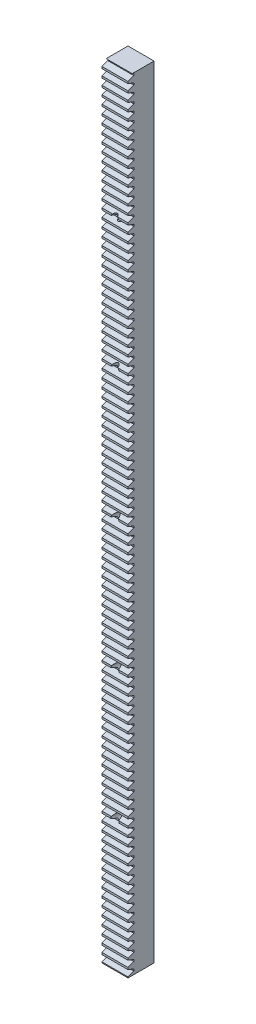
from build123d import *

# Parameters (mm, degrees)
SKETCH_3_W             = 20
SKETCH_3_H             = 20
EXTRUDE_1_DEPTH        = 600
CUT_EXTRUDE_1_REACH    = 602.666
PATTERN_LINEAR_1_COUNT = 96
PATTERN_LINEAR_1_PITCH = 6.27
SKETCH_5_R             = 4
CUT_EXTRUDE_2_DEPTH    = 20
SKETCH_6_R             = 3
CUT_EXTRUDE_3_DEPTH    = 601.666296707


with BuildPart() as part:
    # 草图3 → 凸台-拉伸1 (new body)
    with BuildSketch(Plane(origin=(0, 0, 0), x_dir=(1, 0, 0), z_dir=(0, 1, 0))):
        with Locations((10, 10)):
            Rectangle(SKETCH_3_W, SKETCH_3_H)
    extrude(amount=EXTRUDE_1_DEPTH)

    # 草图4 → 切除-拉伸1 (cut, up to next)
    with BuildSketch(Plane(origin=(0, 0, 0), x_dir=(0, 0, -1), z_dir=(1, 0, 0)), mode=Mode.PRIVATE) as cut_extrude_1_sk1:
        Polygon((0, 0), (0, 0.748566973), (4.5, 2.386433027), (4.5, 3.883566973), (0, 5.521433027), (0, 6.27), (-2, 6.27), (-2, 0), align=None)
    cut_extrude_1_tool1 = extrude(cut_extrude_1_sk1.sketch, amount=CUT_EXTRUDE_1_REACH, mode=Mode.PRIVATE) & part.part
    cut_extrude_1 = cut_extrude_1_tool1.solids().sort_by_distance((0, 3.135, -0.513147))[0]
    add(cut_extrude_1, mode=Mode.SUBTRACT)

    # 阵列(线性)1: 切除-拉伸1 ×96
    with Locations(*[(0, i * PATTERN_LINEAR_1_PITCH, 0) for i in range(1, PATTERN_LINEAR_1_COUNT)]):
        add(cut_extrude_1, mode=Mode.SUBTRACT)

    # 草图5 → 切除-拉伸2 (cut)
    with BuildSketch(Plane(origin=(0, 0, 0), x_dir=(1, 0, 0), z_dir=(0, 1, 0))):
        with Locations(Location((10, 10, 0), (0, 0, 270))):
            Circle(SKETCH_5_R)
    extrude(amount=CUT_EXTRUDE_2_DEPTH, mode=Mode.SUBTRACT)

    # 草图6 → 切除-拉伸3 (cut, through all)
    with BuildSketch(Plane.XY):
        with Locations((10, 100)):
            Circle(SKETCH_6_R)
        with Locations((10, 200)):
            Circle(SKETCH_6_R)
        with Locations((10, 300)):
            Circle(SKETCH_6_R)
        with Locations((10, 400)):
            Circle(SKETCH_6_R)
        with Locations((10, 500)):
            Circle(SKETCH_6_R)
    extrude(amount=-CUT_EXTRUDE_3_DEPTH, mode=Mode.SUBTRACT)


solid = part.part
